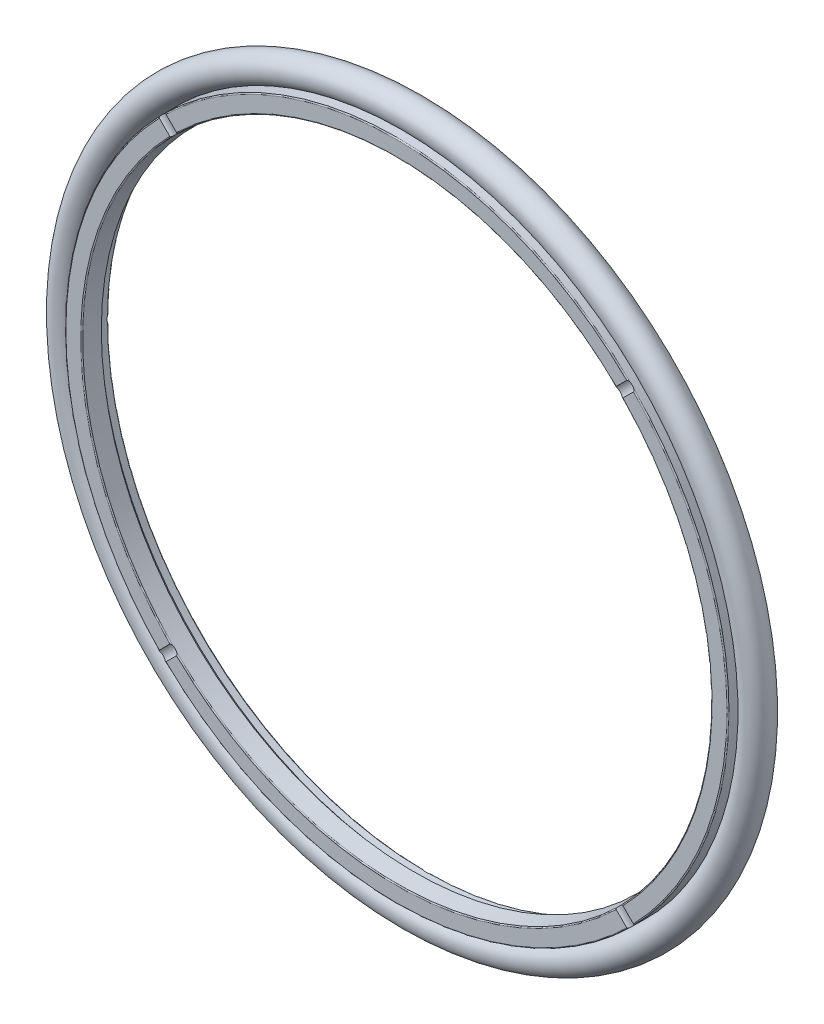
from build123d import *

# Parameters (mm, degrees)
SKETCH4_R          = 2.665
CUT_EXTRUDE1_DEPTH = 98.077355637
CIRPATTERN1_COUNT  = 4
CUT_EXTRUDE2_DEPTH = 98.077355637
CIRPATTERN2_COUNT  = 4


with BuildPart() as part:
    # Sketch1 → Revolve1 (revolve)
    with BuildSketch(Plane(origin=(0, 0, 0), x_dir=(0, 0, -1), z_dir=(1, 0, 0)), mode=Mode.PRIVATE) as revolve1_sk:
        with BuildLine():
            Line((0, 61), (0, 62.95))
            ThreePointArc((0, 62.95), (-0.058578644, 63.091421356), (-0.2, 63.15))
            Line((-0.2, 63.15), (-5.75, 63.15))
            ThreePointArc((-5.75, 63.15), (-5.891421356, 63.091421356), (-5.95, 62.95))
            Line((-5.95, 62.95), (-5.95, 60.133363415))
            ThreePointArc((-5.95, 60.133363415), (-5.897419783, 59.998206441), (-5.767325923, 59.934115298))
            Line((-5.767325923, 59.934115298), (-2.5, 59.65))
            Line((-2.5, 59.65), (-1.5, 60.8))
            Line((-1.5, 60.8), (-0.2, 60.8))
            ThreePointArc((-0.2, 60.8), (-0.058578644, 60.858578644), (0, 61))
        make_face()
    revolve(revolve1_sk.sketch.rotate(Axis((0, 0, 0), (0, 0, 1)), 90), axis=Axis((0, 0, 0), (0, 0, 1)))

    # Sketch2 → Cut-Extrude1 (cut, symmetric)
    with BuildSketch(Plane(origin=(0, 0, 0), x_dir=(0, 0, -1), z_dir=(1, 0, 0))):
        with BuildLine():
            Line((0, 0.9), (0, -0.9))
            ThreePointArc((0, -0.9), (-0.25, 0), (0, 0.9))
        make_face()
    cut_extrude1 = extrude(amount=CUT_EXTRUDE1_DEPTH, both=True, mode=Mode.SUBTRACT)

    # CirPattern1: Cut-Extrude1 ×4 about axis
    cirpattern1_axis = Axis((0, 0, 0), (0, 0, 1))
    for i in range(1, CIRPATTERN1_COUNT):
        add(cut_extrude1.rotate(cirpattern1_axis, i * 360 / CIRPATTERN1_COUNT), mode=Mode.SUBTRACT)

    # Sketch3 → Cut-Extrude2 (cut, symmetric)
    with BuildSketch(Plane(origin=(0, 0, 0), x_dir=(0.7071067811865488, 0.7071067811865462, 0), z_dir=(0.7071067811865462, -0.7071067811865488, 0))):
        with BuildLine():
            Line((-0.9, 5.95), (0.9, 5.95))
            ThreePointArc((0.9, 5.95), (0, 5.7), (-0.9, 5.95))
        make_face()
    cut_extrude2 = extrude(amount=CUT_EXTRUDE2_DEPTH, both=True, mode=Mode.SUBTRACT)

    # CirPattern2: Cut-Extrude2 ×4 about axis
    cirpattern2_axis = Axis((0, 0, 0), (0, 0, 1))
    for i in range(1, CIRPATTERN2_COUNT):
        add(cut_extrude2.rotate(cirpattern2_axis, i * 360 / CIRPATTERN2_COUNT), mode=Mode.SUBTRACT)


with BuildPart() as body_2:
    # Sketch4 → Revolve2 (revolve)
    with BuildSketch(Plane(origin=(0, 0, 0), x_dir=(0, 0, -1), z_dir=(1, 0, 0))):
        with Locations((-2.975, 65.85)):
            Circle(SKETCH4_R)
    revolve(axis=Axis((0, 0, 0), (0, 0, 1)))


solid = Compound([part.part, body_2.part])
